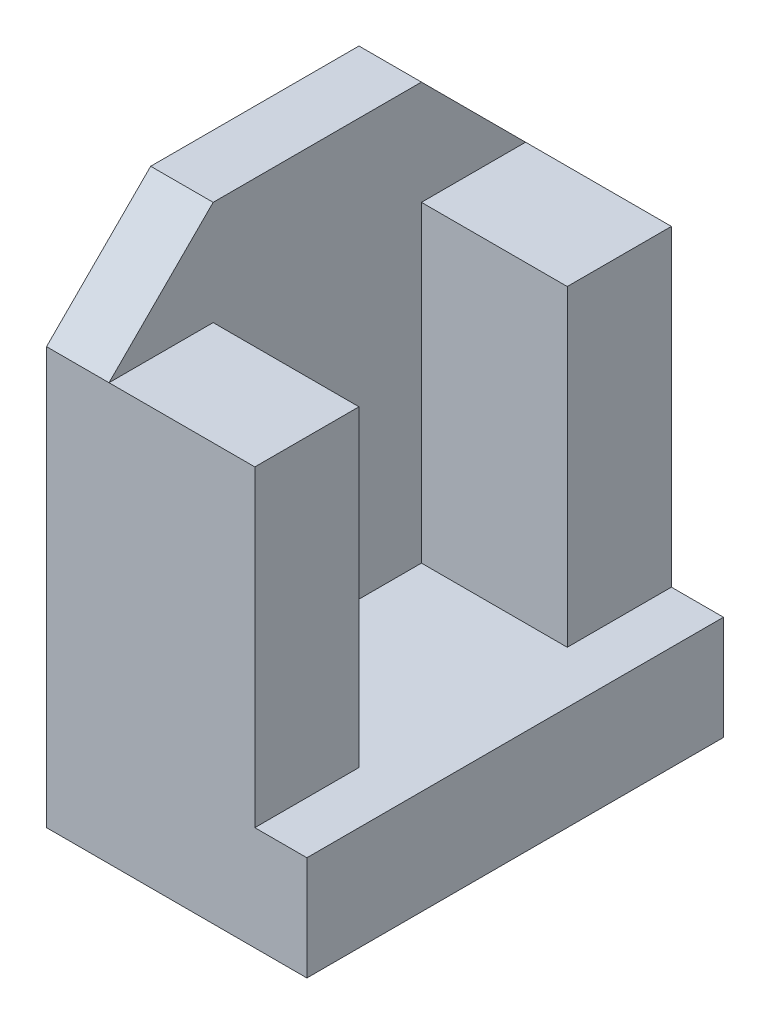
from build123d import *

# Parameters (mm, degrees)
BOSS_EXTRUDE1_DEPTH = 40000
CUT_EXTRUDE1_DEPTH  = 6000
SKETCH3_W           = 10000
SKETCH3_H           = 30000
BOSS_EXTRUDE2_DEPTH = 14000


with BuildPart() as part:
    # Sketch1 → Boss-Extrude1 (new body)
    with BuildSketch(Plane.XY):
        Polygon((6000, 50000), (0, 50000), (0, 0), (25000, 0), (25000, 10000), (6000, 10000), align=None)
    extrude(amount=-BOSS_EXTRUDE1_DEPTH)

    # Sketch2 → Cut-Extrude1 (cut)
    with BuildSketch(Plane.ZY):
        Polygon((-40000, 50000), (-30000, 50000), (-40000, 40000), align=None)
        Polygon((-10000, 50000), (0, 50000), (0, 40000), align=None)
    extrude(amount=-CUT_EXTRUDE1_DEPTH, mode=Mode.SUBTRACT)

    # Sketch3 → Boss-Extrude2 (add)
    with BuildSketch(Plane(origin=(6000, 0, 0), x_dir=(0, 0, -1), z_dir=(1, 0, 0))):
        with Locations((5000, 25000)):
            Rectangle(SKETCH3_W, SKETCH3_H)
        with Locations((35000, 25000)):
            Rectangle(SKETCH3_W, SKETCH3_H)
    extrude(amount=BOSS_EXTRUDE2_DEPTH)


solid = part.part
